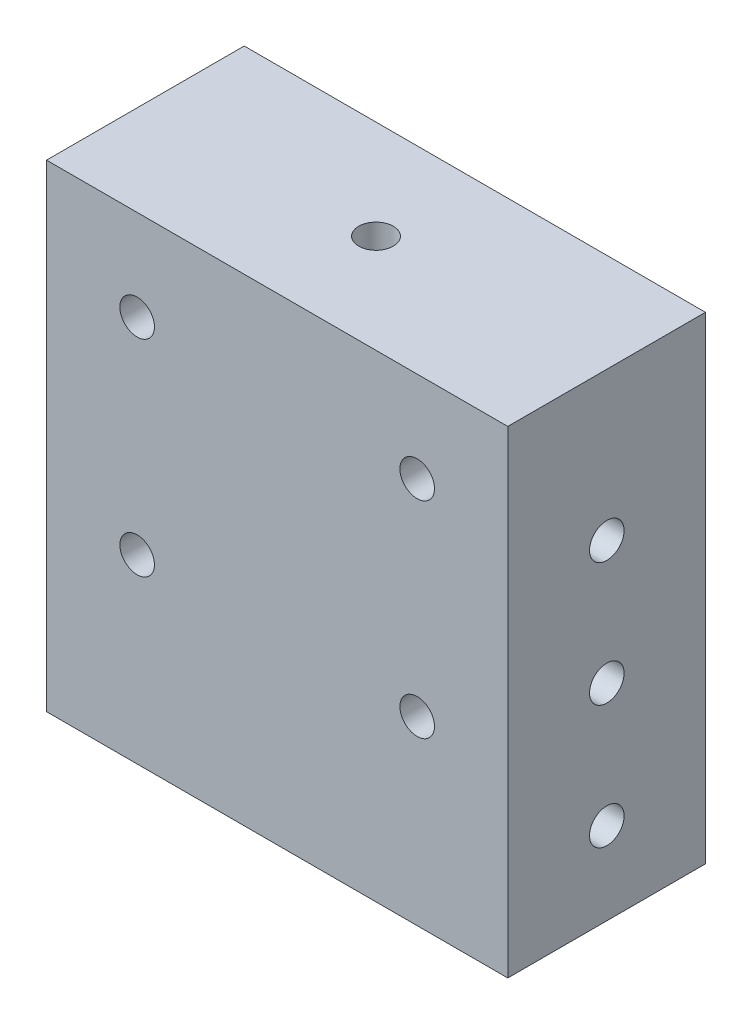
from build123d import *

# Parameters (mm, degrees)
SKETCH1_W             = 40
SKETCH1_H             = 50
BOSS_EXTRUDE1_DEPTH   = 4
SKETCH2_W             = 24
SKETCH2_H             = 58
BOSS_EXTRUDE2_DEPTH   = 8
SKETCH4_W             = 24
SKETCH4_H             = 58
BOSS_EXTRUDE3_DEPTH   = 8
BOSS_EXTRUDE5_DEPTH   = 40
SKETCH6_W             = 32
SKETCH6_H             = 50
CUT_EXTRUDE1_DEPTH    = 8
M5_TAPPED_HOLE3_D     = 4.2
M5_TAPPED_HOLE3_DEPTH = 8
M5_TAPPED_HOLE4_D     = 4.2
M5_TAPPED_HOLE5_D     = 4.2
M5_TAPPED_HOLE5_DEPTH = 8


with BuildPart() as part:
    # Sketch1 → Boss-Extrude1 (new, symmetric)
    with BuildSketch(Plane.XY):
        Rectangle(SKETCH1_W, SKETCH1_H)
    extrude(amount=BOSS_EXTRUDE1_DEPTH, both=True)

    # Sketch2 → Boss-Extrude2 (add)
    with BuildSketch(Plane(origin=(20, 0, 0), x_dir=(0, 0, -1), z_dir=(1, 0, 0))):
        with Locations((8, 4)):
            Rectangle(SKETCH2_W, SKETCH2_H)
    extrude(amount=BOSS_EXTRUDE2_DEPTH)

    # Sketch4 → Boss-Extrude3 (add)
    with BuildSketch(Plane.ZY.offset(20)):
        with Locations((-8, 4)):
            Rectangle(SKETCH4_W, SKETCH4_H)
    extrude(amount=BOSS_EXTRUDE3_DEPTH)

    # Sketch5 → Boss-Extrude5 (add)
    with BuildSketch(Plane.ZY.offset(-20)):
        Polygon((-20, -25), (-20, 33), (4, 33), (4, 25), (-12.05, 25), (-12.05, -25), align=None)
    extrude(amount=BOSS_EXTRUDE5_DEPTH)

    # Sketch6 → Cut-Extrude1 (cut)
    with BuildSketch(Plane(origin=(0, 0, -20), x_dir=(-1, 0, 0), z_dir=(0, 0, -1))):
        Rectangle(SKETCH6_W, SKETCH6_H)
    extrude(amount=-CUT_EXTRUDE1_DEPTH, mode=Mode.SUBTRACT)

    # M5 Tapped Hole3
    with Locations(Plane(origin=(0, 0, -4), x_dir=(-1, 0, 0), z_dir=(0, 0, -1))):
        with Locations((-17, 22), (17, 22), (17, -3), (-17, -3)):
            Hole(M5_TAPPED_HOLE3_D / 2, depth=M5_TAPPED_HOLE3_DEPTH)

    # M5 Tapped Hole4 (through all)
    with Locations(Plane(origin=(0, 33, 0), x_dir=(1, 0, 0), z_dir=(0, 1, 0))):
        with Locations((0, 8)):
            Hole(M5_TAPPED_HOLE4_D / 2)

    # M5 Tapped Hole5
    with Locations(Plane(origin=(28, 0, 0), x_dir=(0, 0, -1), z_dir=(1, 0, 0))):
        with Locations((8.025, 15), (8.025, 0), (8.025, -15)):
            Hole(M5_TAPPED_HOLE5_D / 2, depth=M5_TAPPED_HOLE5_DEPTH)


solid = part.part
